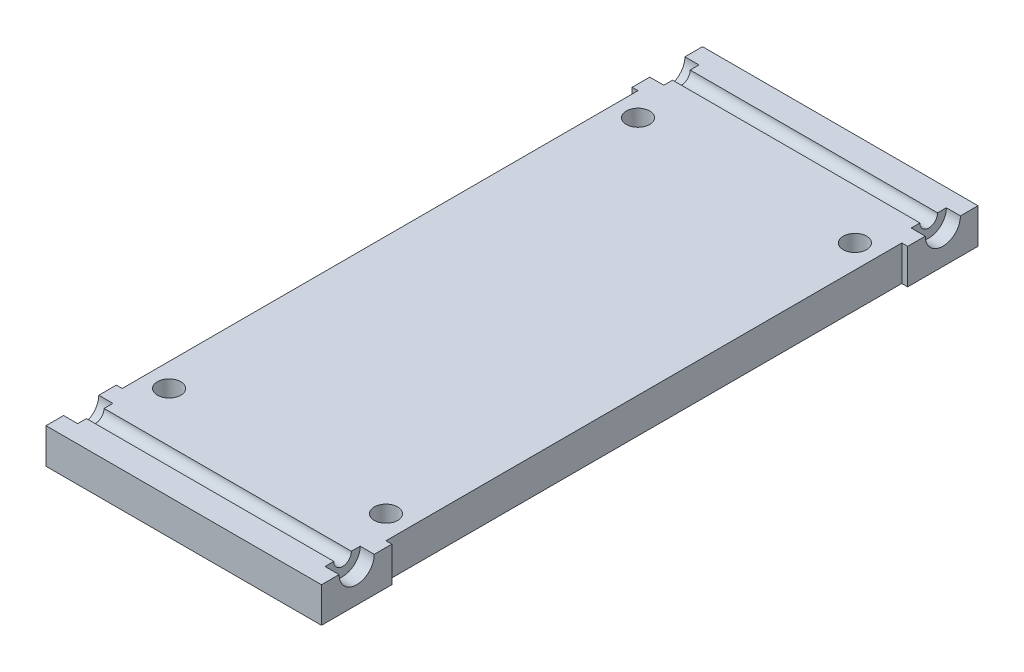
from build123d import *

# Parameters (mm, degrees)
SKETCH_4_W          = 23.5
SKETCH_4_H          = 56
EXTRUDE_1_DEPTH     = 3
SKETCH_5_R          = 0.75
CUT_EXTRUDE_1_DEPTH = 37.67764987
SKETCH_5_3_R        = 1.5
CUT_EXTRUDE_4_DEPTH = 1.2
CUT_EXTRUDE_START   = -22.3
SKETCH_5_4_R        = 1.5
CUT_EXTRUDE_5_DEPTH = 1.2
SKETCH_6_R          = 1.5
SKETCH_6_R_2        = 1
CUT_EXTRUDE_2_DEPTH = 1
SKETCH_6_2_R        = 1
CUT_EXTRUDE_3_DEPTH = 31.513316765
SKETCH_7_W          = 44
SKETCH_7_H          = 3
CUT_EXTRUDE_8_DEPTH = 0.5
CUT_EXTRUDE_START_2 = -23.5
SKETCH_7_2_W        = 44
SKETCH_7_2_H        = 3
CUT_EXTRUDE_9_DEPTH = 0.5


with BuildPart() as part:
    # 草图4 → 凸台-拉伸1 (new body)
    with BuildSketch(Plane(origin=(0, 0, 0), x_dir=(1, 0, 0), z_dir=(0, 1, 0))):
        Rectangle(SKETCH_4_W, SKETCH_4_H)
    extrude(amount=EXTRUDE_1_DEPTH)

    # 草图5 → 切除-拉伸1 (cut, through all)
    with BuildSketch(Plane(origin=(11.75, 0, 0), x_dir=(0, 0, -1), z_dir=(1, 0, 0))):
        with Locations((-25, 3)):
            Circle(SKETCH_5_R)
        with Locations((25, 3)):
            Circle(SKETCH_5_R)
    extrude(amount=-CUT_EXTRUDE_1_DEPTH, mode=Mode.SUBTRACT)

    # 草图5<3> → 切除-拉伸4 (cut)
    with BuildSketch(Plane(origin=(11.75, 0, 0), x_dir=(0, 0, -1), z_dir=(1, 0, 0))):
        with Locations((-25, 3)):
            Circle(SKETCH_5_3_R)
        with Locations((25, 3)):
            Circle(SKETCH_5_3_R)
    extrude(amount=-CUT_EXTRUDE_4_DEPTH, mode=Mode.SUBTRACT)

    # 草图5<4> → 切除-拉伸5 (cut)
    with BuildSketch(Plane(origin=(11.75, 0, 0), x_dir=(0, 0, -1), z_dir=(1, 0, 0)).offset(CUT_EXTRUDE_START)):
        with Locations((-25, 3)):
            Circle(SKETCH_5_4_R)
        with Locations((25, 3)):
            Circle(SKETCH_5_4_R)
    extrude(amount=-CUT_EXTRUDE_5_DEPTH, mode=Mode.SUBTRACT)

    # 草图6 → 切除-拉伸2 (cut)
    # profile 1 of 4: a face of its own
    with BuildSketch(Plane.XZ):
        with Locations(Location((-9.25, -20, 0), (0, 0, 270))):
            Circle(SKETCH_6_R)
        with Locations(Location((-9.25, -20, 0), (0, 0, 270))):
            Circle(SKETCH_6_R_2, mode=Mode.SUBTRACT)
    # profile 2 of 4: a face of its own
    with BuildSketch(Plane.XZ):
        with Locations(Location((9.25, -20, 0), (0, 0, 270))):
            Circle(SKETCH_6_R)
        with Locations(Location((9.25, -20, 0), (0, 0, 270))):
            Circle(SKETCH_6_R_2, mode=Mode.SUBTRACT)
    # profile 3 of 4: a face of its own
    with BuildSketch(Plane.XZ):
        with Locations(Location((-9.25, 20, 0), (0, 0, 270))):
            Circle(SKETCH_6_R)
        with Locations(Location((-9.25, 20, 0), (0, 0, 270))):
            Circle(SKETCH_6_R_2, mode=Mode.SUBTRACT)
    # profile 4 of 4: a face of its own
    with BuildSketch(Plane.XZ):
        with Locations(Location((9.25, 20, 0), (0, 0, 270))):
            Circle(SKETCH_6_R)
        with Locations(Location((9.25, 20, 0), (0, 0, 270))):
            Circle(SKETCH_6_R_2, mode=Mode.SUBTRACT)
    extrude(amount=-CUT_EXTRUDE_2_DEPTH, mode=Mode.SUBTRACT)

    # 草图6<2> → 切除-拉伸3 (cut, through all)
    with BuildSketch(Plane.XZ):
        with Locations(Location((-9.25, -20, 0), (0, 0, 270))):
            Circle(SKETCH_6_2_R)
        with Locations(Location((9.25, -20, 0), (0, 0, 270))):
            Circle(SKETCH_6_2_R)
        with Locations(Location((-9.25, 20, 0), (0, 0, 270))):
            Circle(SKETCH_6_2_R)
        with Locations(Location((9.25, 20, 0), (0, 0, 270))):
            Circle(SKETCH_6_2_R)
    extrude(amount=-CUT_EXTRUDE_3_DEPTH, mode=Mode.SUBTRACT)

    # 草图7 → 切除-拉伸8 (cut)
    with BuildSketch(Plane.ZY.offset(11.75)):
        with Locations((0, 1.5)):
            Rectangle(SKETCH_7_W, SKETCH_7_H)
    extrude(amount=-CUT_EXTRUDE_8_DEPTH, mode=Mode.SUBTRACT)

    # 草图7<2> → 切除-拉伸9 (cut)
    with BuildSketch(Plane.ZY.offset(11.75).offset(CUT_EXTRUDE_START_2)):
        with Locations((0, 1.5)):
            Rectangle(SKETCH_7_2_W, SKETCH_7_2_H)
    extrude(amount=CUT_EXTRUDE_9_DEPTH, mode=Mode.SUBTRACT)


solid = part.part
